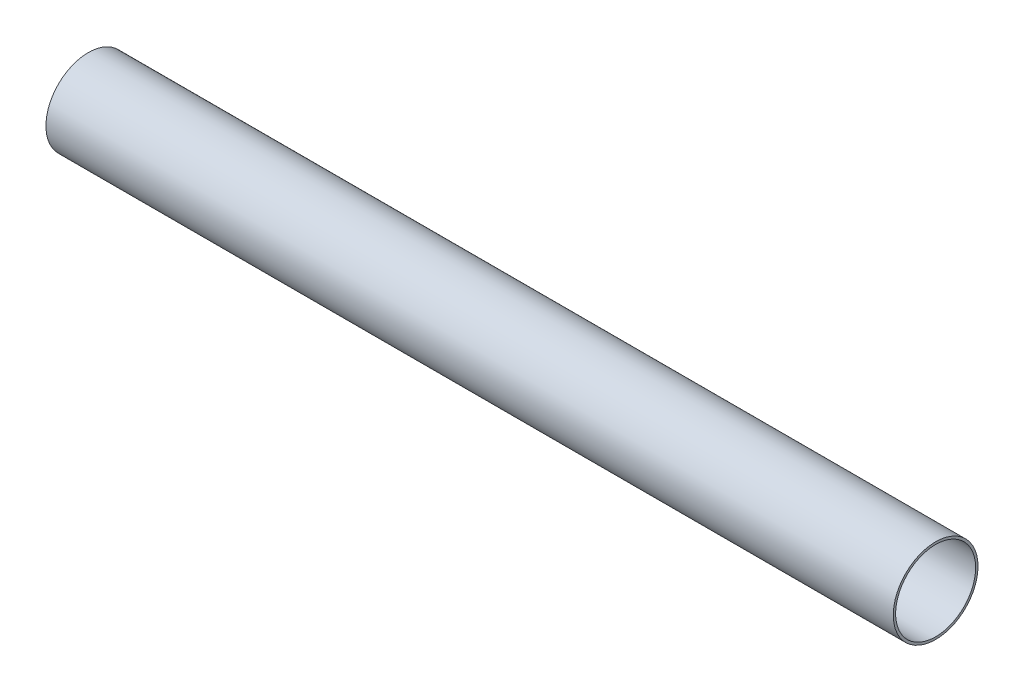
from build123d import *

# Parameters (mm, degrees)
SKETCH3_R           = 12.7
SKETCH3_R_2         = 11.9888
BOSS_EXTRUDE1_DEPTH = 127


with BuildPart() as part:
    # Sketch3 → Boss-Extrude1 (new, symmetric)
    with BuildSketch(Plane(origin=(0, 0, 0), x_dir=(0, 0, -1), z_dir=(1, 0, 0))):
        Circle(SKETCH3_R)
        Circle(SKETCH3_R_2, mode=Mode.SUBTRACT)
    extrude(amount=BOSS_EXTRUDE1_DEPTH, both=True)


solid = part.part
